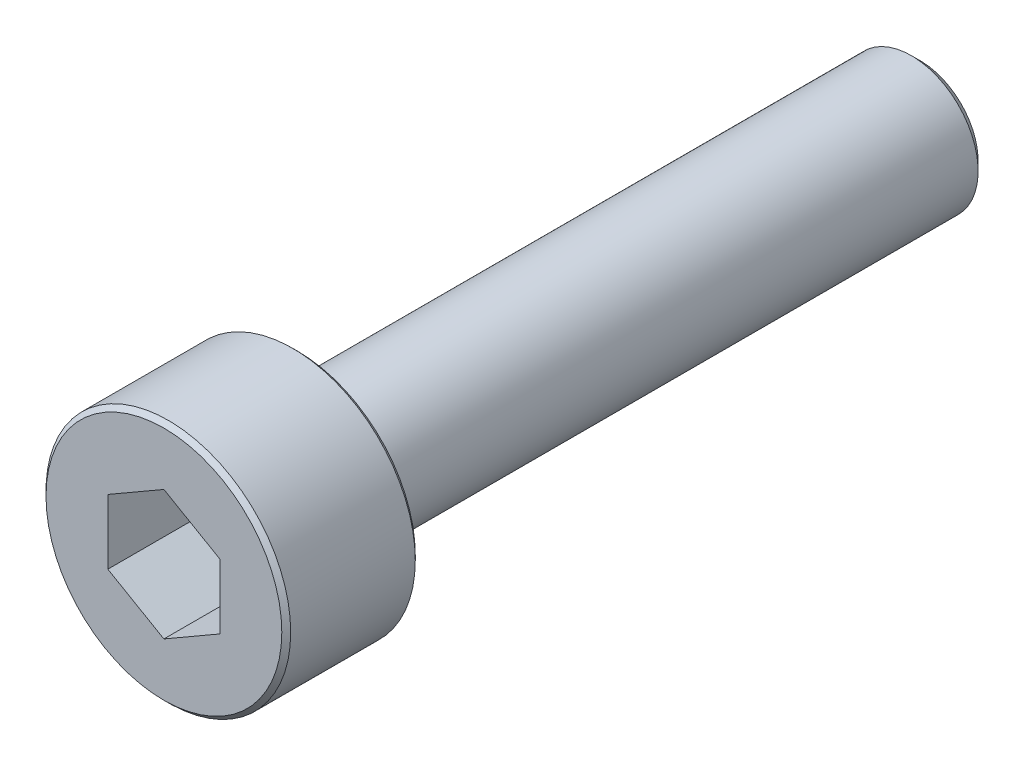
from build123d import *

# Parameters (mm, degrees)
SKETCH_1_W          = 2.75
SKETCH_1_H          = 3
SKETCH_2_R          = 1.5
EXTRUDE_1_DEPTH     = 14
CUT_EXTRUDE_1_DEPTH = 2.25
CHAMFER_1_SIZE2     = 0.100001195
CHAMFER_1_SIZE      = 0.100001132
CHAMFER_2_SIZE      = 0.200007871
CHAMFER_2_SIZE2     = 0.200009082


with BuildPart() as part:
    # 草图1 → 旋转1 (revolve)
    with BuildSketch(Plane(origin=(0, 0, 0), x_dir=(1, 0, 0), z_dir=(0, 1, 0))):
        with Locations((1.375, -15.5)):
            Rectangle(SKETCH_1_W, SKETCH_1_H)
    revolve(axis=Axis((0, 0, 14), (0, 0, 1)))

    # 草图2 → 凸台-拉伸1 (add)
    with BuildSketch(Plane(origin=(0, 0, 14), x_dir=(-1, 0, 0), z_dir=(0, 0, -1))):
        Circle(SKETCH_2_R)
    extrude(amount=EXTRUDE_1_DEPTH)

    # 草图3 → 切除-拉伸1 (cut)
    with BuildSketch(Plane.XY.offset(17)):
        Polygon((-1.26, -0.727461339), (0, -1.454922678), (1.26, -0.727461339), (1.26, 0.727461339), (0, 1.454922678), (-1.26, 0.727461339), align=None)
    extrude(amount=-CUT_EXTRUDE_1_DEPTH, mode=Mode.SUBTRACT)

    # 倒角1
    chamfer_1_edges = [part.edges().sort_by_distance(p)[0] for p in [
        (-2.75, 0, 17),
        (-2.75, 0, 14),
    ]]
    chamfer(chamfer_1_edges, length=CHAMFER_1_SIZE, length2=CHAMFER_1_SIZE2)

    # 倒角2
    chamfer_2_edges = [part.edges().sort_by_distance(p)[0] for p in [
        (1.5, 0, 0),
    ]]
    chamfer_2_side = [part.faces().sort_by_distance(p)[0] for p in [
        (1.5, 0, 7),
    ]]
    chamfer(chamfer_2_edges, length=CHAMFER_2_SIZE, length2=CHAMFER_2_SIZE2, reference=chamfer_2_side[0])


solid = part.part
